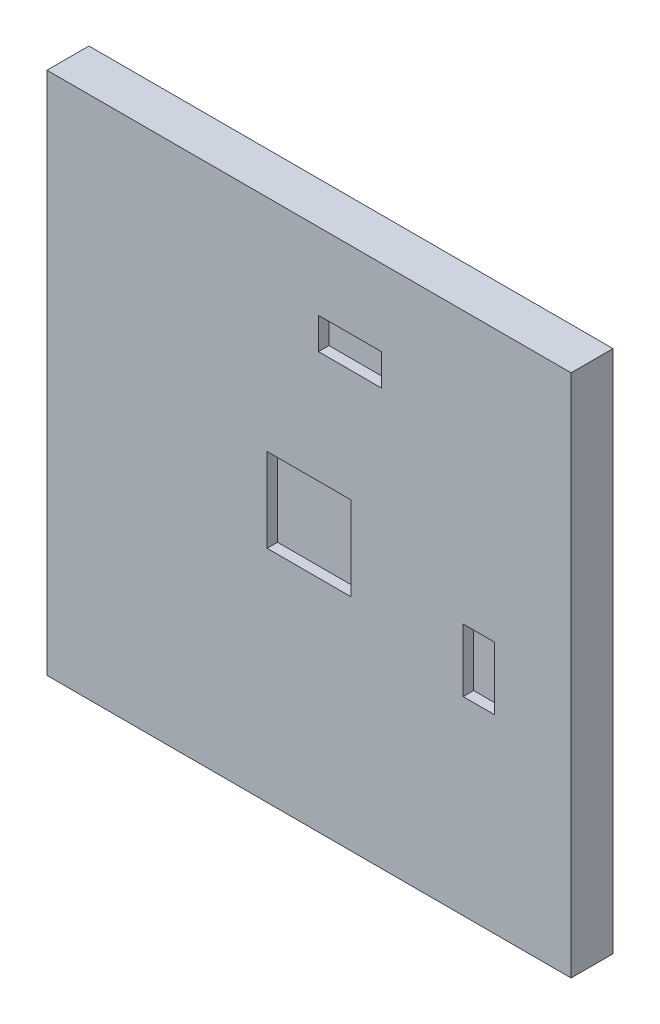
from build123d import *

# Parameters (mm, degrees)
SKETCH1_W           = 250
SKETCH1_H           = 250
BOSS_EXTRUDE1_DEPTH = 20
SKETCH2_W           = 40
SKETCH2_H           = 40
SKETCH2_W_2         = 30
SKETCH2_H_2         = 15
CUT_EXTRUDE2_DEPTH  = 5


with BuildPart() as part:
    # Sketch1 → Boss-Extrude1 (new body)
    with BuildSketch(Plane.XY):
        with Locations((22.048407602, -70.903707865)):
            Rectangle(SKETCH1_W, SKETCH1_H)
    extrude(amount=BOSS_EXTRUDE1_DEPTH)

    # Sketch2 → Cut-Extrude2 (cut)
    with BuildSketch(Plane.XY.offset(20)):
        Polygon((95.548407602, -105.403707865), (110.548407602, -105.403707865), (110.548407602, -90.403707865), (110.548407602, -75.403707865), (95.548407602, -75.403707865), align=None)
        with Locations((22.048407602, -70.903707865)):
            Rectangle(SKETCH2_W, SKETCH2_H)
        with Locations((41.548407602, 10.096292135)):
            Rectangle(SKETCH2_W_2, SKETCH2_H_2)
    extrude(amount=-CUT_EXTRUDE2_DEPTH, mode=Mode.SUBTRACT)


solid = part.part
